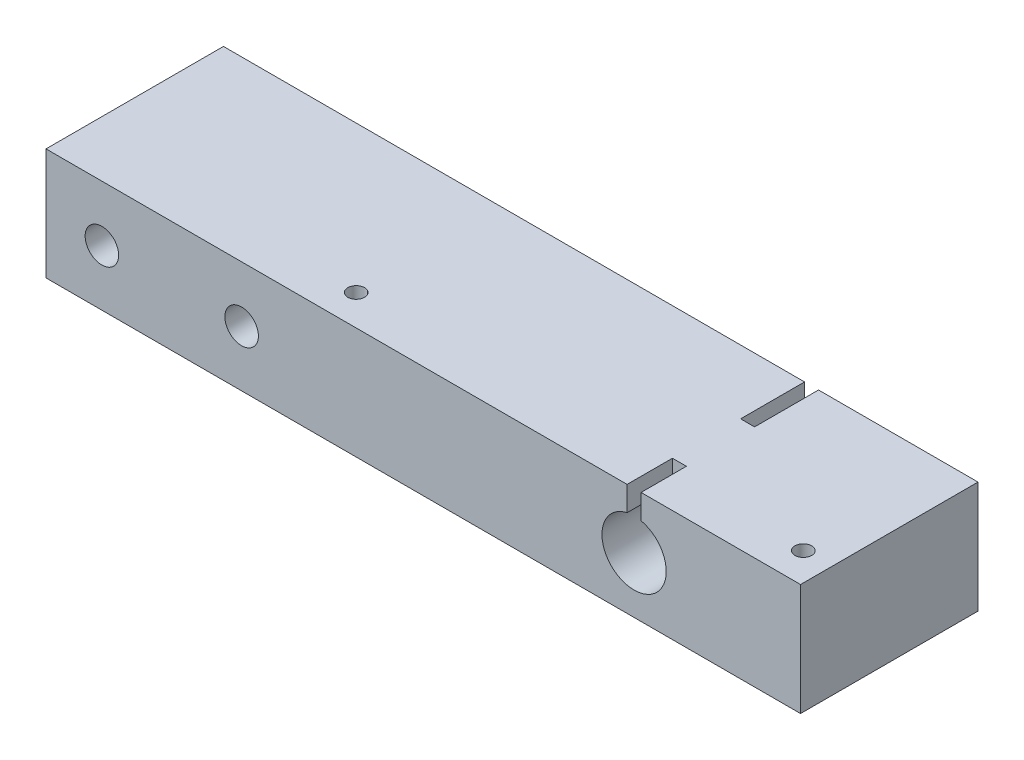
from build123d import *

# Parameters (mm, degrees)
SKETCH1_W           = 54
SKETCH1_H           = 8
BOSS_EXTRUDE1_DEPTH = 12.7
SKETCH3_W           = 1
SKETCH3_H           = 3.243111396
SKETCH3_H_2         = 4.577374163
CUT_EXTRUDE1_DEPTH  = 2
SKETCH4_R           = 2.3
CUT_EXTRUDE2_DEPTH  = 57.047212241
SKETCH5_R           = 0.6
CUT_EXTRUDE3_DEPTH  = 57.047212241
SKETCH6_R           = 1.2
CUT_EXTRUDE4_DEPTH  = 57.047212241
SKETCH12_R          = 0.6
CUT_EXTRUDE6_DEPTH  = 15
SKETCH14_R          = 0.6
CUT_EXTRUDE7_DEPTH  = 6


with BuildPart() as part:
    # Sketch1 → Boss-Extrude1 (new body)
    with BuildSketch(Plane.XY):
        with Locations((27, 4)):
            Rectangle(SKETCH1_W, SKETCH1_H)
    extrude(amount=BOSS_EXTRUDE1_DEPTH)

    # Sketch3 → Cut-Extrude1 (cut)
    with BuildSketch(Plane(origin=(0, 8, 0), x_dir=(1, 0, 0), z_dir=(0, 1, 0))):
        with Locations((42.087715046, -11.078444302)):
            Rectangle(SKETCH3_W, SKETCH3_H)
        with Locations((42.087715046, -2.288687081)):
            Rectangle(SKETCH3_W, SKETCH3_H_2)
    extrude(amount=-CUT_EXTRUDE1_DEPTH, mode=Mode.SUBTRACT)

    # Sketch4 → Cut-Extrude2 (cut, through all)
    with BuildSketch(Plane.XY.offset(12.7)):
        with Locations(Location((42.087715046, 4, 0), (0, 0, 77.444142201))):
            Circle(SKETCH4_R)
    extrude(amount=-CUT_EXTRUDE2_DEPTH, mode=Mode.SUBTRACT)

    # Sketch5 → Cut-Extrude3 (cut, through all)
    with BuildSketch(Plane(origin=(0, 8, 0), x_dir=(1, 0, 0), z_dir=(0, 1, 0))):
        with Locations(Location((52, -10.5, 0), (0, 0, 270))):
            Circle(SKETCH5_R)
        with Locations(Location((20, -10.5, 0), (0, 0, 270))):
            Circle(SKETCH5_R)
    extrude(amount=-CUT_EXTRUDE3_DEPTH, mode=Mode.SUBTRACT)

    # Sketch6 → Cut-Extrude4 (cut, through all)
    with BuildSketch(Plane.XY.offset(12.7)):
        with Locations((4, 4)):
            Circle(SKETCH6_R)
        with Locations((14, 4)):
            Circle(SKETCH6_R)
    extrude(amount=-CUT_EXTRUDE4_DEPTH, mode=Mode.SUBTRACT)

    # Sketch12 → Cut-Extrude6 (cut)
    with BuildSketch(Plane(origin=(25.944559134, 0, 23.885086629), x_dir=(-0.677303634830695, 0, 0.7357035994509805), z_dir=(-0.7357035994509805, 0, -0.677303634830695))):
        with Locations(Location((-22.135860185, 4, 0), (0, 0, 180))):
            Circle(SKETCH12_R)
    extrude(amount=CUT_EXTRUDE6_DEPTH, mode=Mode.SUBTRACT)

    # Sketch14 → Cut-Extrude7 (cut)
    with BuildSketch(Plane(origin=(0, 0, 0), x_dir=(-1, 0, 0), z_dir=(0, 0, -1))):
        with Locations((-44.387715046, 4)):
            Circle(SKETCH14_R)
    extrude(amount=-CUT_EXTRUDE7_DEPTH, mode=Mode.SUBTRACT)


solid = part.part
